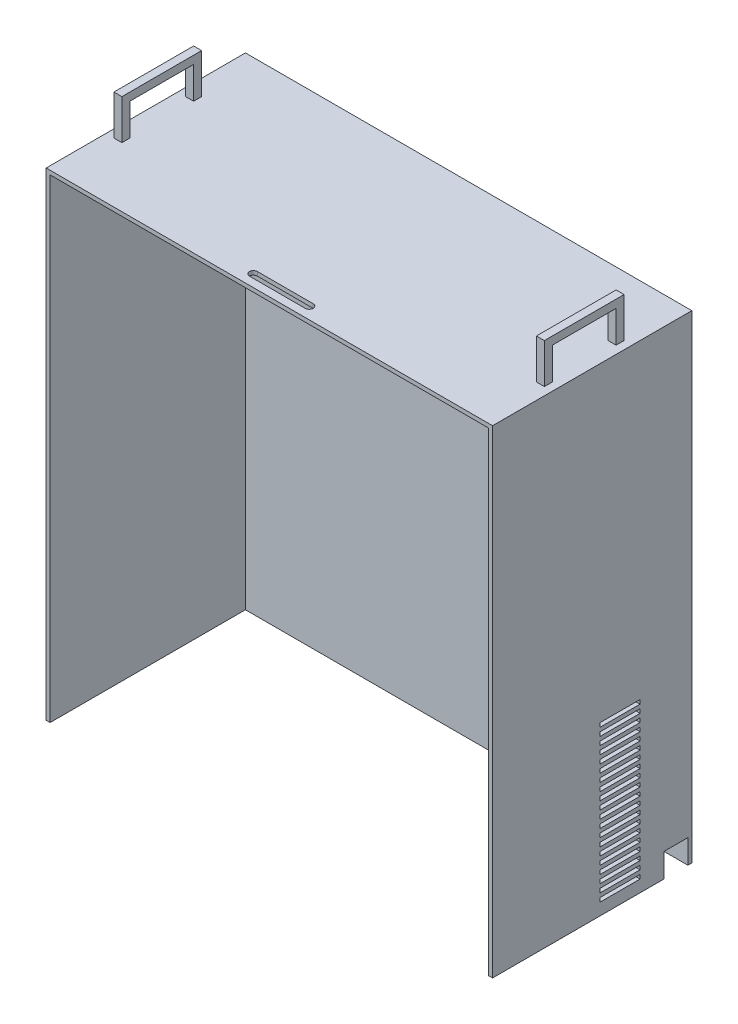
from build123d import *

# Parameters (mm, degrees)
ESBO_O1_W                = 560
ESBO_O1_H                = 500
RESSALTO_EXTRUS_O1_DEPTH = 600
ESBO_O2_W                = 570
ESBO_O2_H                = 610
CORTE_EXTRUS_O1_DEPTH    = 250
ESBO_O6_W                = 550
ESBO_O6_H                = 595
CORTE_EXTRUS_O4_DEPTH    = 245
ESBO_O7_W                = 30
ESBO_O7_H                = 30
CABO_DE_ALIMENTA_O_DEPTH = 5
ESBO_O9_W                = 50
ESBO_O9_H                = 5
CORTE_EXTRUS_O6_DEPTH    = 5
PASSAGEM_FILAMENTO_DEPTH = 5
ESBO_O69_W               = 10
ESBO_O69_H               = 100
AL_A_2_DEPTH             = 50
ESBO_O70_W               = 80
ESBO_O70_H               = 40
AL_A_2_2_DEPTH           = 10
ESBO_O72_W               = 10
ESBO_O72_H               = 100
AL_A_1_DEPTH             = 50
ESBO_O74_W               = 80
ESBO_O74_H               = 40
AL_A_1_2_DEPTH           = 10


with BuildPart() as part:
    # Esboço1 → Ressalto-extrusão1 (new body)
    with BuildSketch(Plane(origin=(0, 0, 0), x_dir=(1, 0, 0), z_dir=(0, 1, 0))):
        Rectangle(ESBO_O1_W, ESBO_O1_H)
    extrude(amount=RESSALTO_EXTRUS_O1_DEPTH)

    # Esboço2 → Corte-extrusão1 (cut)
    with BuildSketch(Plane.XY.offset(250)):
        with Locations((0, 300)):
            Rectangle(ESBO_O2_W, ESBO_O2_H)
    extrude(amount=-CORTE_EXTRUS_O1_DEPTH, mode=Mode.SUBTRACT)

    # Esboço6 → Corte-extrusão4 (cut)
    with BuildSketch(Plane.XY):
        with Locations((0, 297.5)):
            Rectangle(ESBO_O6_W, ESBO_O6_H)
    extrude(amount=-CORTE_EXTRUS_O4_DEPTH, mode=Mode.SUBTRACT)

    # Esboço7 → Cabo de alimentação (cut)
    with BuildSketch(Plane(origin=(280, 0, 0), x_dir=(0, 0, -1), z_dir=(1, 0, 0))):
        with Locations((230, 15)):
            Rectangle(ESBO_O7_W, ESBO_O7_H)
    extrude(amount=-CABO_DE_ALIMENTA_O_DEPTH, mode=Mode.SUBTRACT)

    # Esboço9 → Corte-extrusão6 (cut)
    with BuildSketch(Plane(origin=(280, 0, 0), x_dir=(0, 0, -1), z_dir=(1, 0, 0))):
        with Locations((160, 17.5)):
            Rectangle(ESBO_O9_W, ESBO_O9_H)
        with Locations((160, 27.5)):
            Rectangle(ESBO_O9_W, ESBO_O9_H)
        with Locations((160, 47.5)):
            Rectangle(ESBO_O9_W, ESBO_O9_H)
        with Locations((160, 37.5)):
            Rectangle(ESBO_O9_W, ESBO_O9_H)
        with Locations((160, 67.5)):
            Rectangle(ESBO_O9_W, ESBO_O9_H)
        with Locations((160, 77.5)):
            Rectangle(ESBO_O9_W, ESBO_O9_H)
        with Locations((160, 87.5)):
            Rectangle(ESBO_O9_W, ESBO_O9_H)
        with Locations((160, 57.5)):
            Rectangle(ESBO_O9_W, ESBO_O9_H)
        with Locations((160, 107.5)):
            Rectangle(ESBO_O9_W, ESBO_O9_H)
        with Locations((160, 157.5)):
            Rectangle(ESBO_O9_W, ESBO_O9_H)
        with Locations((160, 117.5)):
            Rectangle(ESBO_O9_W, ESBO_O9_H)
        with Locations((160, 167.5)):
            Rectangle(ESBO_O9_W, ESBO_O9_H)
        with Locations((160, 127.5)):
            Rectangle(ESBO_O9_W, ESBO_O9_H)
        with Locations((160, 97.5)):
            Rectangle(ESBO_O9_W, ESBO_O9_H)
        with Locations((160, 147.5)):
            Rectangle(ESBO_O9_W, ESBO_O9_H)
        with Locations((160, 137.5)):
            Rectangle(ESBO_O9_W, ESBO_O9_H)
        with Locations((160, 177.5)):
            Rectangle(ESBO_O9_W, ESBO_O9_H)
        with Locations((160, 187.5)):
            Rectangle(ESBO_O9_W, ESBO_O9_H)
        with Locations((160, 207.5)):
            Rectangle(ESBO_O9_W, ESBO_O9_H)
        with Locations((160, 197.5)):
            Rectangle(ESBO_O9_W, ESBO_O9_H)
    extrude(amount=-CORTE_EXTRUS_O6_DEPTH, mode=Mode.SUBTRACT)

    # Esboço68 → Passagem Filamento (cut)
    with BuildSketch(Plane(origin=(0, 600, 0), x_dir=(1, 0, 0), z_dir=(0, 1, 0))):
        with BuildLine():
            Line((-35, 20), (35, 20))
            ThreePointArc((35, 20), (40, 15), (35, 10))
            Line((35, 10), (-35, 10))
            ThreePointArc((-35, 10), (-40, 15), (-35, 20))
        make_face()
    extrude(amount=-PASSAGEM_FILAMENTO_DEPTH, mode=Mode.SUBTRACT)

    # Esboço69 → Al_a - 2 (add)
    with BuildSketch(Plane(origin=(0, 600, 0), x_dir=(1, 0, 0), z_dir=(0, 1, 0))):
        with Locations((-265, 125)):
            Rectangle(ESBO_O69_W, ESBO_O69_H)
    extrude(amount=AL_A_2_DEPTH)

    # Esboço70 → Al_a _2 2 (cut)
    with BuildSketch(Plane.ZY.offset(270)):
        with Locations((-125, 620)):
            Rectangle(ESBO_O70_W, ESBO_O70_H)
    extrude(amount=-AL_A_2_2_DEPTH, mode=Mode.SUBTRACT)

    # Esboço72 → Al_a - 1 (add)
    with BuildSketch(Plane(origin=(531.113648875, 600, -10.670910915), x_dir=(1, 0, 0), z_dir=(0, 1, 0))):
        with Locations((-266.113648875, 114.329089085)):
            Rectangle(ESBO_O72_W, ESBO_O72_H)
    extrude(amount=AL_A_1_DEPTH)

    # Esboço74 → Al_a _1 2 (cut)
    with BuildSketch(Plane(origin=(260, 0, -10.670910915), x_dir=(0, 0, 1), z_dir=(-1, 0, 0))):
        with Locations((-114.329089085, 620)):
            Rectangle(ESBO_O74_W, ESBO_O74_H)
    extrude(amount=-AL_A_1_2_DEPTH, mode=Mode.SUBTRACT)


solid = part.part
